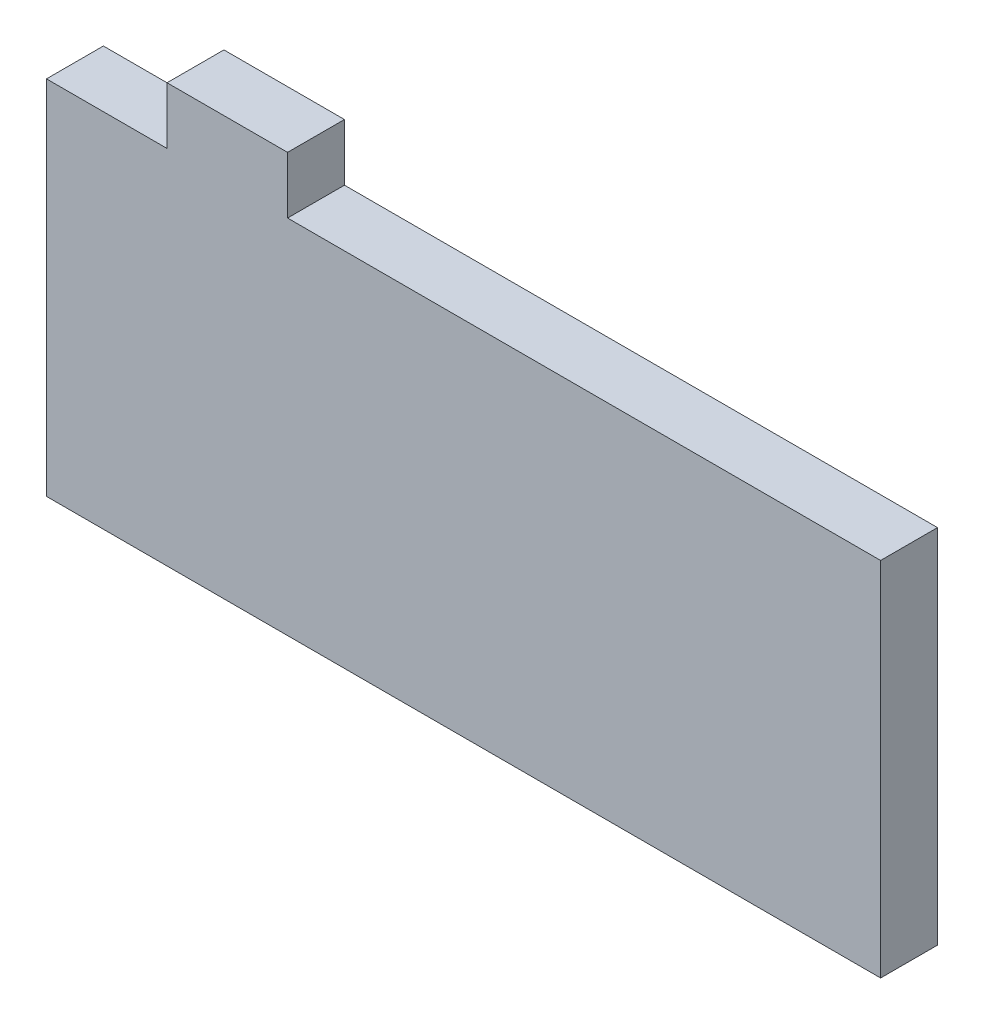
from build123d import *

# Parameters (mm, degrees)
SKETCH1_W  = 43.942
SKETCH1_H  = 19.05
BODY_DEPTH = 2.9972
SKETCH2_W  = 6.35
SKETCH2_H  = 2.9972
TAB_DEPTH  = 2.9972


with BuildPart() as part:
    # Sketch1 → Body (new body)
    with BuildSketch(Plane.XY):
        Rectangle(SKETCH1_W, SKETCH1_H)
    extrude(amount=BODY_DEPTH)

    # Sketch2 → Tab (add)
    with BuildSketch(Plane(origin=(0, 9.525, 0), x_dir=(1, 0, 0), z_dir=(0, 1, 0))):
        with Locations((-12.446, -1.4986)):
            Rectangle(SKETCH2_W, SKETCH2_H)
    extrude(amount=TAB_DEPTH)


solid = part.part
